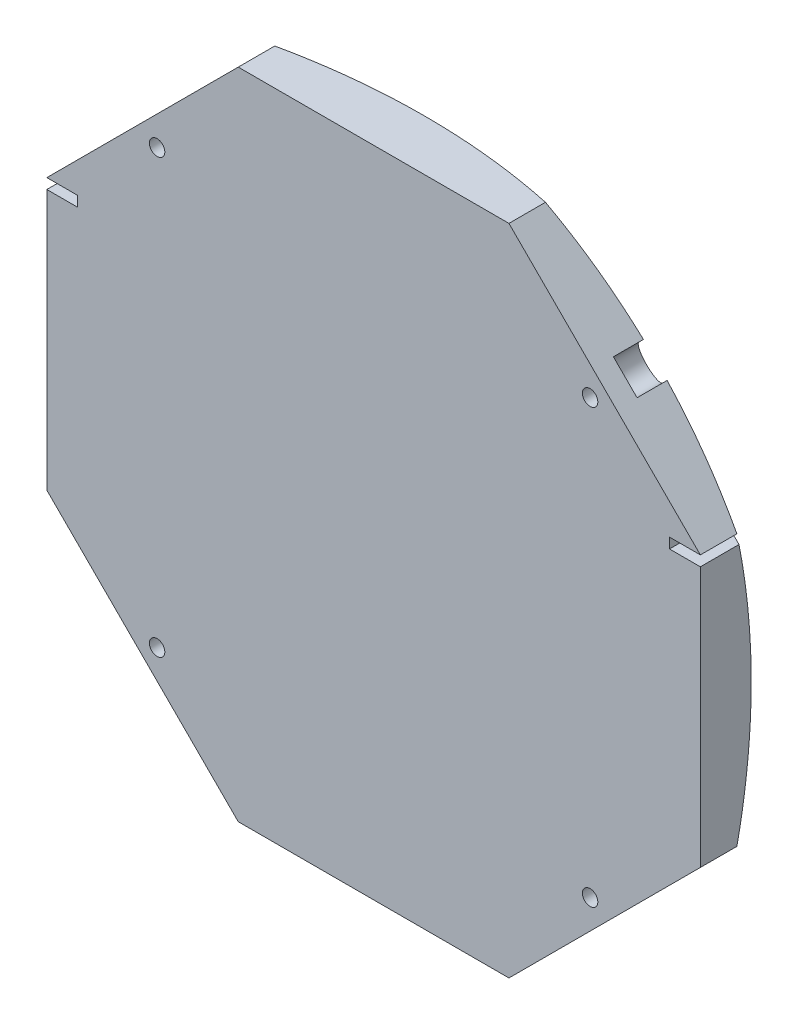
from build123d import *

# Parameters (mm, degrees)
ESBO_O1_OUTSIDE_W     = 192.158
ESBO_O1_OUTSIDE_H     = 192.158
CORTE_EXTRUS_O1_DEPTH = 108.596468344
CORTE_EXTRUS_O2_START = -4
ESBO_O3_W             = 70
ESBO_O3_H             = 70
CORTE_EXTRUS_O2_DEPTH = 90.21748763
FILETE1_R             = 15
ESBO_O4_W             = 127
ESBO_O4_H             = 2
CORTE_EXTRUS_O4_DEPTH = 92.320862119
ESBO_O5_W             = 6
ESBO_O5_H             = 2
CORTE_EXTRUS_O5_DEPTH = 92.320862119
ESBO_O6_R             = 1.5
CORTE_EXTRUS_O7_DEPTH = 93.131236882
CORTE_EXTRUS_O8_START = -4
CORTE_EXTRUS_O8_DEPTH = 89.131236882


with BuildPart() as part:
    # Esboço2 → Revolução1 (revolve)
    with BuildSketch(Plane(origin=(0, 0, 0), x_dir=(0, 0, -1), z_dir=(1, 0, 0)), mode=Mode.PRIVATE) as revolu_o1_sk:
        with BuildLine():
            Line((0, 74), (4, 74))
            ThreePointArc((4, 74), (19.648353468, 38.461019227), (25, 0))
            Line((25, 0), (0, 0))
            Line((0, 0), (0, 74))
        make_face()
    revolve(revolu_o1_sk.sketch.rotate(Axis((0, 0, 0), (0, 0, -1)), 90), axis=Axis((0, 0, 0), (0, 0, -1)))

    # Esboço1 outside → Corte-extrusão1 (cut, through all)
    with BuildSketch(Plane.XY):
        Rectangle(ESBO_O1_OUTSIDE_W, ESBO_O1_OUTSIDE_H)
        Polygon((63.5, 26.302561211), (26.302561211, 63.5), (-26.302561211, 63.5), (-63.5, 26.302561211), (-63.5, -26.302561211), (-26.302561211, -63.5), (26.302561211, -63.5), (63.5, -26.302561211), align=None, mode=Mode.SUBTRACT)
    extrude(amount=-CORTE_EXTRUS_O1_DEPTH, mode=Mode.SUBTRACT)

    # Esboço3 → Corte-extrusão2 (cut, through all)
    with BuildSketch(Plane.XY.offset(CORTE_EXTRUS_O2_START)):
        Rectangle(ESBO_O3_W, ESBO_O3_H)
    extrude(amount=-CORTE_EXTRUS_O2_DEPTH, mode=Mode.SUBTRACT)

    # Filete1
    filete1_edges = [part.edges().sort_by_distance(p)[0] for p in [
        (35, 35, -10.009206795),
        (35, -35, -10.009206795),
        (-35, -35, -10.009206795),
        (-35, 35, -10.009206795),
    ]]
    fillet(filete1_edges, radius=FILETE1_R)

    # Esboço4 → Corte-extrusão4 (cut, through all)
    with BuildSketch(Plane.XY.offset(-4)):
        with Locations((0, 25.302561211)):
            Rectangle(ESBO_O4_W, ESBO_O4_H)
    extrude(amount=-CORTE_EXTRUS_O4_DEPTH, mode=Mode.SUBTRACT)

    # Esboço5 → Corte-extrusão5 (cut, through all)
    with BuildSketch(Plane(origin=(0, 0, -4), x_dir=(-1, 0, 0), z_dir=(0, 0, -1))):
        with Locations((-60.5, 25.302561211)):
            Rectangle(ESBO_O5_W, ESBO_O5_H)
        with Locations((60.5, 25.302561211)):
            Rectangle(ESBO_O5_W, ESBO_O5_H)
    extrude(amount=-CORTE_EXTRUS_O5_DEPTH, mode=Mode.SUBTRACT)

    # Esboço6 → Corte-extrusão7 (cut, through all)
    with BuildSketch(Plane.XY):
        with Locations((42.072853481, -42.072853481)):
            Circle(ESBO_O6_R)
        with Locations((-42.072853481, -42.072853481)):
            Circle(ESBO_O6_R)
        with Locations((-42.072853481, 42.072853481)):
            Circle(ESBO_O6_R)
        with Locations((42.072853481, 42.072853481)):
            Circle(ESBO_O6_R)
    extrude(amount=-CORTE_EXTRUS_O7_DEPTH, mode=Mode.SUBTRACT)

    # Esboço7 → Corte-extrusão8 (cut, through all)
    with BuildSketch(Plane.XY.offset(CORTE_EXTRUS_O8_START)):
        with BuildLine():
            Line((42.603183566, 47.199377644), (39.774756442, 44.370950519))
            ThreePointArc((39.774756442, 44.370950519), (39.774756442, 39.774756442), (44.370950519, 39.774756442))
            Line((44.370950519, 39.774756442), (47.199377644, 42.603183566))
            Line((47.199377644, 42.603183566), (42.603183566, 47.199377644))
        make_face()
        with BuildLine():
            Line((-47.199377644, 42.603183566), (-44.370950519, 39.774756442))
            ThreePointArc((-44.370950519, 39.774756442), (-39.774756442, 39.774756442), (-39.774756442, 44.370950519))
            Line((-39.774756442, 44.370950519), (-42.603183566, 47.199377644))
            Line((-42.603183566, 47.199377644), (-47.199377644, 42.603183566))
        make_face()
        with BuildLine():
            Line((47.199377644, -42.603183566), (44.370950519, -39.774756442))
            ThreePointArc((44.370950519, -39.774756442), (39.774756442, -39.774756442), (39.774756442, -44.370950519))
            Line((39.774756442, -44.370950519), (42.603183566, -47.199377644))
            Line((42.603183566, -47.199377644), (47.199377644, -42.603183566))
        make_face()
        with BuildLine():
            Line((-42.603183566, -47.199377644), (-39.774756442, -44.370950519))
            ThreePointArc((-39.774756442, -44.370950519), (-39.774756442, -39.774756442), (-44.370950519, -39.774756442))
            Line((-44.370950519, -39.774756442), (-47.199377644, -42.603183566))
            Line((-47.199377644, -42.603183566), (-42.603183566, -47.199377644))
        make_face()
    extrude(amount=-CORTE_EXTRUS_O8_DEPTH, mode=Mode.SUBTRACT)


solid = part.part
